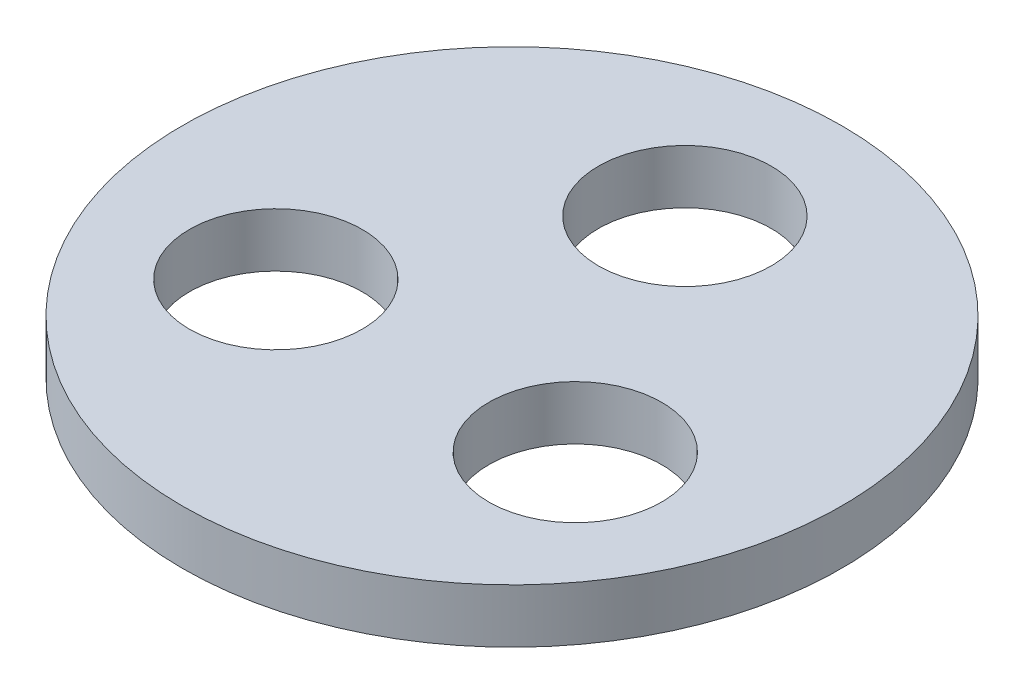
from build123d import *

# Parameters (mm, degrees)
SZKIC1_R                    = 61
SZKIC1_R_2                  = 16
DODANIE_WYCI_GNI_CIE1_DEPTH = 10


with BuildPart() as part:
    # Szkic1 → Dodanie-wyciągnięcie1 (new body)
    with BuildSketch(Plane(origin=(0, 0, 0), x_dir=(1, 0, 0), z_dir=(0, 1, 0))):
        with Locations(Location((0, 0, 0), (0, 0, 270))):
            Circle(SZKIC1_R)
        with Locations(Location((0, 32, 0), (0, 0, 270))):
            Circle(SZKIC1_R_2, mode=Mode.SUBTRACT)
        with Locations(Location((27.712812921, -16, 0), (0, 0, 270))):
            Circle(SZKIC1_R_2, mode=Mode.SUBTRACT)
        with Locations(Location((-27.712812921, -16, 0), (0, 0, 270))):
            Circle(SZKIC1_R_2, mode=Mode.SUBTRACT)
    extrude(amount=DODANIE_WYCI_GNI_CIE1_DEPTH)


solid = part.part
